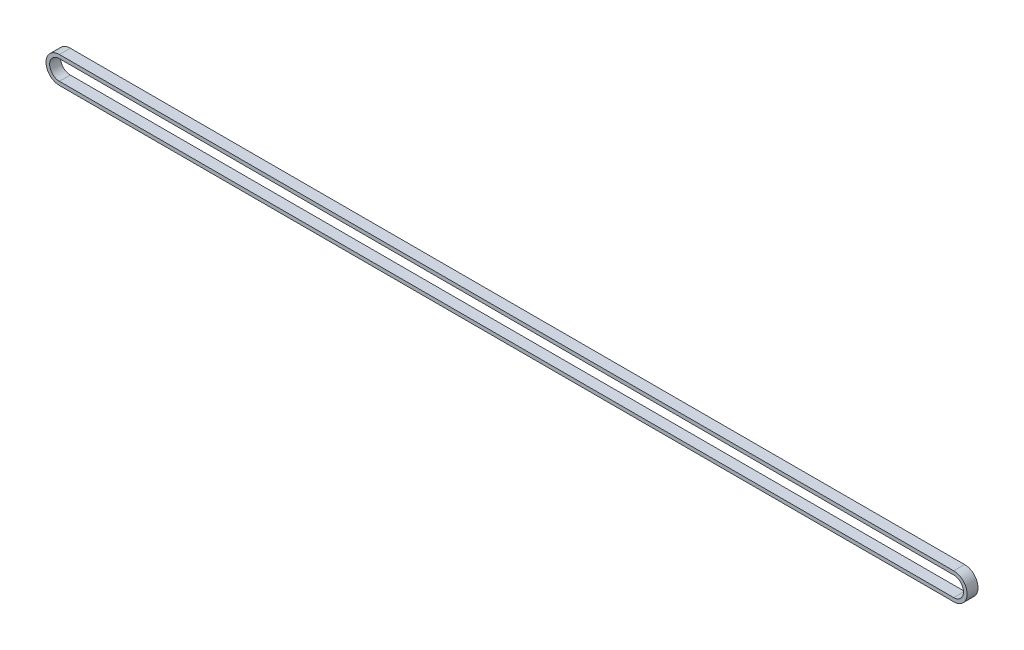
from build123d import *

# Parameters (mm, degrees)
RESSALTO_EXTRUS_O1_DEPTH = 3


with BuildPart() as part:
    # Esboço1 → Ressalto-extrusão1 (new, symmetric)
    with BuildSketch(Plane.XY):
        with BuildLine():
            ThreePointArc((246.5, -7.4), (253.9, 0), (246.5, 7.4))
            Line((246.5, 7.4), (-246.5, 7.4))
            ThreePointArc((-246.5, 7.4), (-253.9, 0), (-246.5, -7.4))
            Line((-246.5, -7.4), (246.5, -7.4))
        make_face()
        with BuildLine():
            Line((-246.5, 5.4), (246.5, 5.4))
            ThreePointArc((246.5, 5.4), (251.9, 0), (246.5, -5.4))
            Line((246.5, -5.4), (-246.5, -5.4))
            ThreePointArc((-246.5, -5.4), (-251.9, 0), (-246.5, 5.4))
        make_face(mode=Mode.SUBTRACT)
    extrude(amount=RESSALTO_EXTRUS_O1_DEPTH, both=True)


solid = part.part
